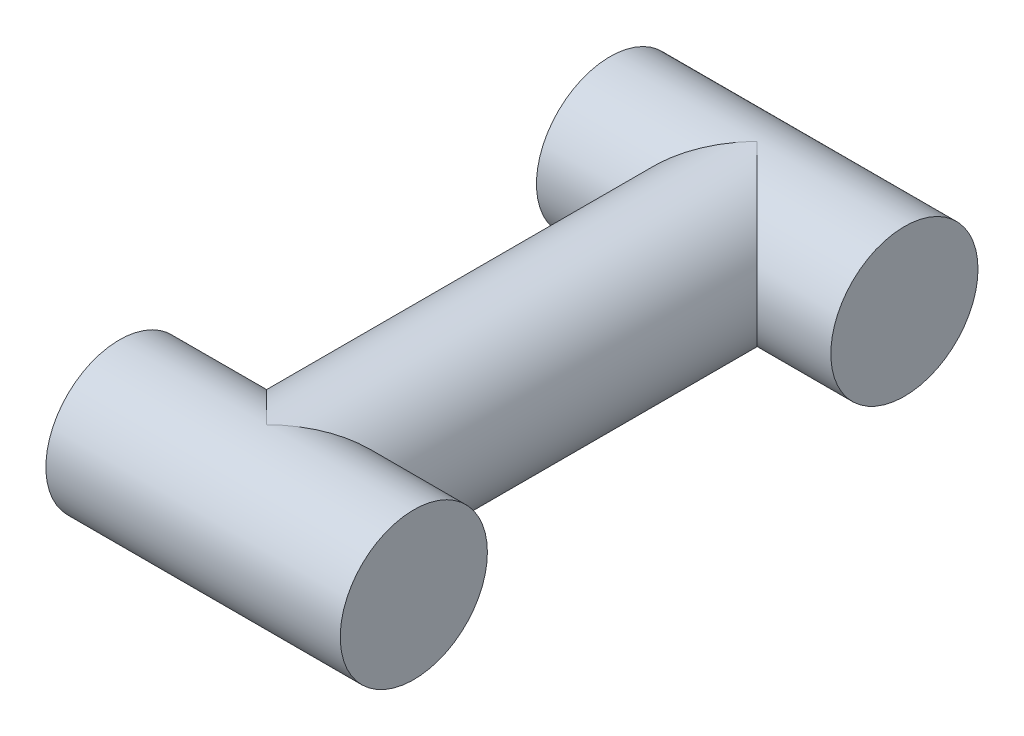
from build123d import *

# Parameters (mm, degrees)
SKETCH_7_R      = 15
EXTRUDE_5_DEPTH = 30
SKETCH_8_R      = 15
EXTRUDE_6_DEPTH = 100
SKETCH_9_R      = 15
EXTRUDE_7_DEPTH = 30


with BuildPart() as part:
    # 草图7 → 凸台-拉伸5 (new, symmetric)
    with BuildSketch(Plane(origin=(0, 0, 0), x_dir=(0, 0, -1), z_dir=(1, 0, 0))):
        with Locations(Location((0, 0, 0), (0, 0, 180))):
            Circle(SKETCH_7_R)
    extrude(amount=EXTRUDE_5_DEPTH, both=True)

    # 草图8 → 凸台-拉伸6 (add)
    with BuildSketch(Plane.XY):
        with Locations(Location((0, 0, 0), (0, 0, 90))):
            Circle(SKETCH_8_R)
    extrude(amount=EXTRUDE_6_DEPTH)

    # 草图9 → 凸台-拉伸7 (add, symmetric)
    with BuildSketch(Plane(origin=(0, 0, 0), x_dir=(0, 0, -1), z_dir=(1, 0, 0))):
        with Locations((-100, 0)):
            Circle(SKETCH_9_R)
    extrude(amount=EXTRUDE_7_DEPTH, both=True)


solid = part.part
